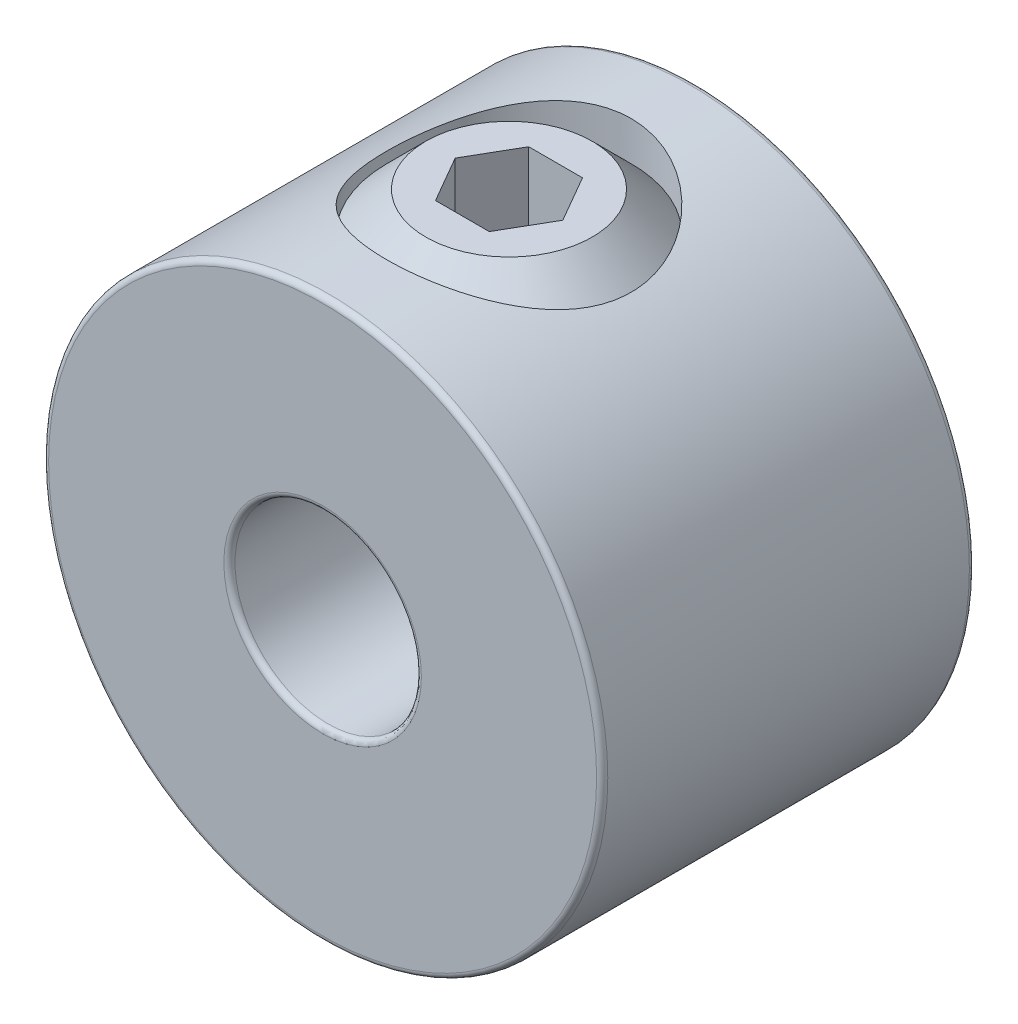
from build123d import *

# Parameters (mm, degrees)
SKETCH1_R          = 4.7625
SKETCH1_R_2        = 1.5875
EXTRUDE1_DEPTH     = 3.175
SKETCH2_R          = 2.0828
CUT_EXTRUDE1_DEPTH = 47.391954448
FILLET1_R          = 0.09525
CUT_EXTRUDE2_DEPTH = 1.5875


with BuildPart() as part:
    # Sketch1 → Extrude1 (new, symmetric)
    with BuildSketch(Plane.XY):
        Circle(SKETCH1_R)
        Circle(SKETCH1_R_2, mode=Mode.SUBTRACT)
    extrude(amount=EXTRUDE1_DEPTH, both=True)

    # Sketch2 → Cut-Extrude1 (cut, through all)
    with BuildSketch(Plane(origin=(41.275, 0, 0), x_dir=(0, 0, -1), z_dir=(0, -1, 0))):
        with Locations((0, -41.275)):
            Circle(SKETCH2_R)
    extrude(amount=-CUT_EXTRUDE1_DEPTH, mode=Mode.SUBTRACT)

    # Fillet1
    fillet1_edges = [part.edges().sort_by_distance(p)[0] for p in [
        (-4.7625, 0, -3.175),
        (-4.7625, 0, 3.175),
        (-1.5875, 0, -3.175),
        (-1.5875, 0, 3.175),
    ]]
    fillet(fillet1_edges, radius=FILLET1_R)


with BuildPart() as body_2:
    # Sketch3 → Revolve1 (revolve)
    with BuildSketch(Plane.XY):
        Polygon((-1.416367744, 1.5875), (-0.799718707, 1.5875), (0, 2.387218707), (0, 4.7625), (-1.416367744, 4.7625), (-2.0828, 4.096067744), (-2.0828, 2.253932256), align=None)
    revolve(axis=Axis((0, 1.5875, 0), (0, -1, 0)))

    # Sketch4 → Cut-Extrude2 (cut)
    with BuildSketch(Plane(origin=(3.3734375, 4.7625, 0), x_dir=(0, 0, -1), z_dir=(0, -1, 0))):
        Polygon((0, -2.456893948), (-0.79375, -2.915165724), (-0.79375, -3.831709276), (0, -4.289981052), (0.79375, -3.831709276), (0.79375, -2.915165724), align=None)
    extrude(amount=CUT_EXTRUDE2_DEPTH, mode=Mode.SUBTRACT)


solid = Compound([part.part, body_2.part])
